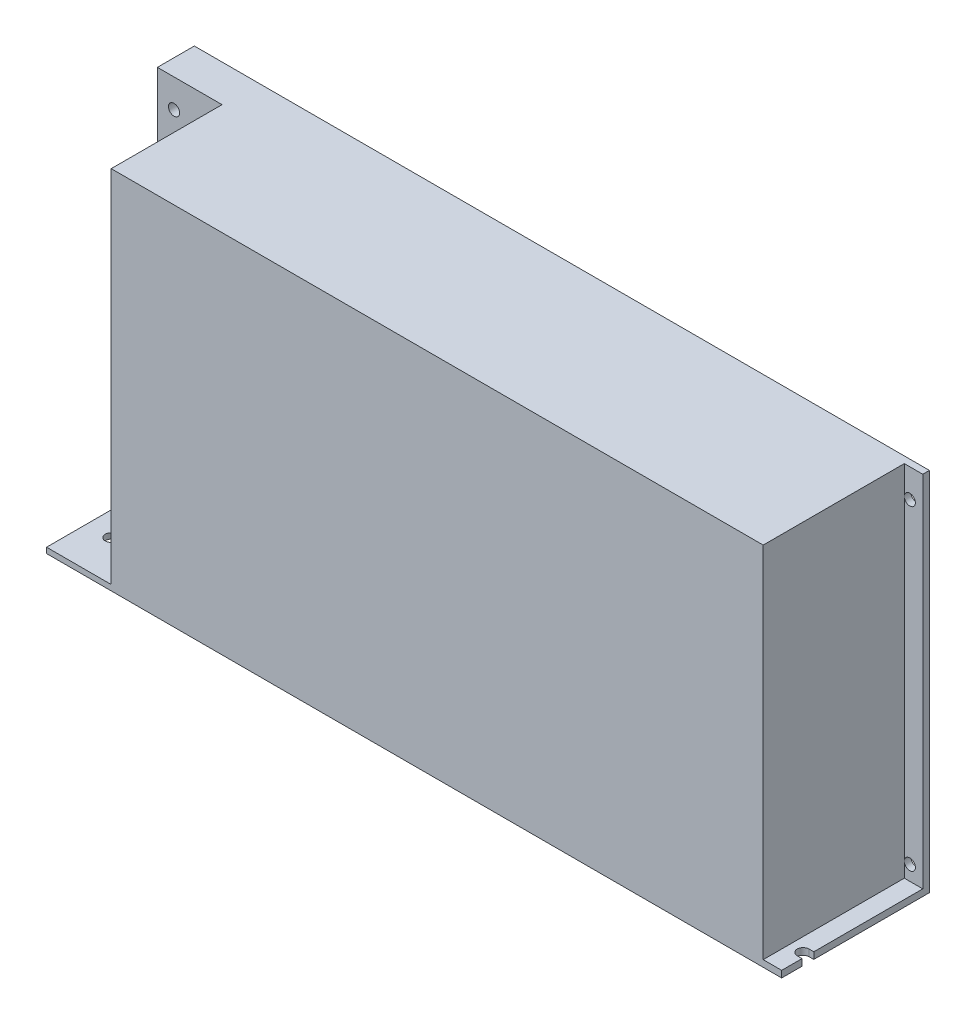
from build123d import *

# Parameters (mm, degrees)
SKETCH_1_W          = 199
SKETCH_1_H          = 99
EXTRUDE_1_DEPTH     = 40
SKETCH_3_W          = 17.5
SKETCH_3_H          = 97.5
CUT_EXTRUDE_2_DEPTH = 30
SKETCH_6_W          = 5
SKETCH_6_H          = 38.2
CUT_EXTRUDE_5_DEPTH = 97.2
SKETCH_7_W          = 17.5
SKETCH_7_H          = 9
CUT_EXTRUDE_6_DEPTH = 8.2
SKETCH_2_R          = 2
CUT_EXTRUDE_1_DEPTH = 10
SKETCH_4_R          = 1.5
CUT_EXTRUDE_3_DEPTH = 10
SKETCH_5_R          = 1.6
CUT_EXTRUDE_4_DEPTH = 10
SKETCH_8_R          = 1.5
CUT_EXTRUDE_7_DEPTH = 119.11223476


with BuildPart() as part:
    # 草图1 → 拉伸1 (new body)
    with BuildSketch(Plane.XY):
        Rectangle(SKETCH_1_W, SKETCH_1_H)
    extrude(amount=EXTRUDE_1_DEPTH)

    # 草图3 → 切除-拉伸2 (cut)
    with BuildSketch(Plane.XY.offset(40)):
        with Locations((-90.75, 0.75)):
            Rectangle(SKETCH_3_W, SKETCH_3_H)
    extrude(amount=-CUT_EXTRUDE_2_DEPTH, mode=Mode.SUBTRACT)

    # 草图6 → 切除-拉伸5 (cut)
    with BuildSketch(Plane(origin=(0, 49.5, 0), x_dir=(-1, 0, 0), z_dir=(0, 1, 0))):
        with Locations((-97, 20.9)):
            Rectangle(SKETCH_6_W, SKETCH_6_H)
    extrude(amount=-CUT_EXTRUDE_5_DEPTH, mode=Mode.SUBTRACT)

    # 草图7 → 切除-拉伸6 (cut)
    with BuildSketch(Plane.XY.offset(10)):
        with Locations((-90.75, -43.5)):
            Rectangle(SKETCH_7_W, SKETCH_7_H)
    extrude(amount=-CUT_EXTRUDE_6_DEPTH, mode=Mode.SUBTRACT)

    # 草图2 → 切除-拉伸1 (cut)
    with BuildSketch(Plane.XY):
        with Locations((-41.5, 39.8)):
            Circle(SKETCH_2_R)
        with Locations((78.5, 39.8)):
            Circle(SKETCH_2_R)
        with Locations((-41.5, -40.2)):
            Circle(SKETCH_2_R)
        with Locations((78.5, -40.2)):
            Circle(SKETCH_2_R)
    extrude(amount=CUT_EXTRUDE_1_DEPTH, mode=Mode.SUBTRACT)

    # 草图4 → 切除-拉伸3 (cut)
    with BuildSketch(Plane.XZ.offset(49.5)):
        with Locations(Location((-79.5, 20, 0), (0, 0, 270))):
            Circle(SKETCH_4_R)
        with Locations(Location((77.5, 12.5, 0), (0, 0, 270))):
            Circle(SKETCH_4_R)
        with Locations(Location((77.5, 30.5, 0), (0, 0, 270))):
            Circle(SKETCH_4_R)
    extrude(amount=-CUT_EXTRUDE_3_DEPTH, mode=Mode.SUBTRACT)

    # 草图5 → 切除-拉伸4 (cut)
    with BuildSketch(Plane.XZ.offset(49.5)):
        with Locations(Location((-93, 29, 0), (0, 0, 270))):
            Circle(SKETCH_5_R)
        with BuildLine():
            Line((99.5, 34.5), (99.5, 31.3))
            Line((99.5, 31.3), (98.2, 31.3))
            ThreePointArc((98.2, 31.3), (96.6, 32.9), (98.2, 34.5))
            Line((98.2, 34.5), (99.5, 34.5))
        make_face()
    extrude(amount=-CUT_EXTRUDE_4_DEPTH, mode=Mode.SUBTRACT)

    # 草图8 → 切除-拉伸7 (cut, through all)
    with BuildSketch(Plane(origin=(0, 0, 0), x_dir=(-1, 0, 0), z_dir=(0, 0, -1))):
        with Locations((-96, 41.8)):
            Circle(SKETCH_8_R)
        with Locations((-96, -43.7)):
            Circle(SKETCH_8_R)
        with Locations((95, -43.7)):
            Circle(SKETCH_8_R)
        with Locations(Location((95, 41.8, 0), (0, 0, 180))):
            Circle(SKETCH_8_R)
    extrude(amount=-CUT_EXTRUDE_7_DEPTH, mode=Mode.SUBTRACT)


solid = part.part
